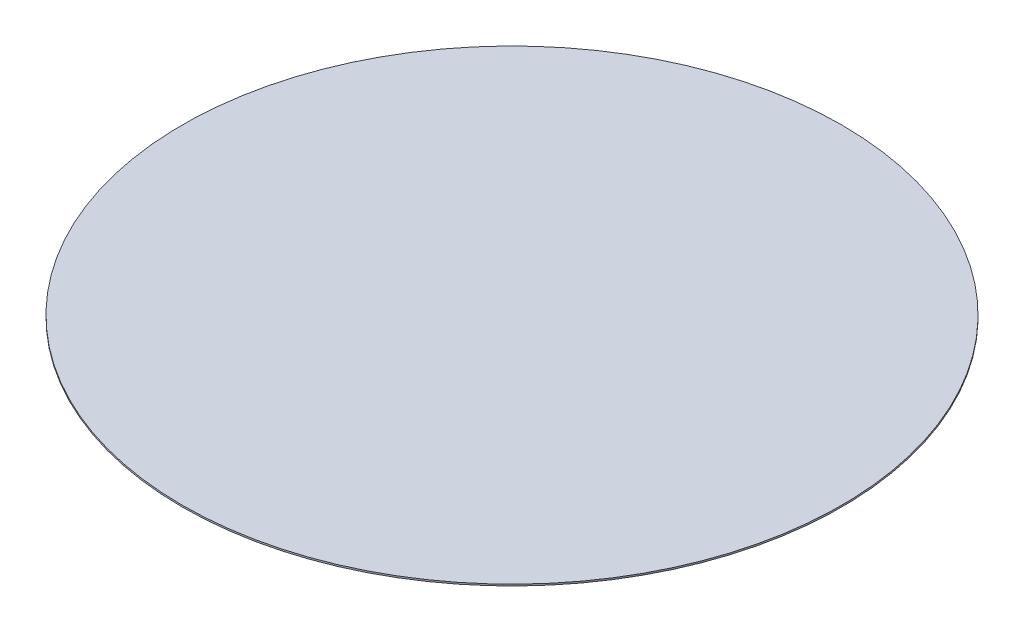
from build123d import *

# Parameters (mm, degrees)
SKETCH1_R           = 10.25
BOSS_EXTRUDE1_DEPTH = 0.05


with BuildPart() as part:
    # Sketch1 → Boss-Extrude1 (new body)
    with BuildSketch(Plane(origin=(0, 0, 0), x_dir=(1, 0, 0), z_dir=(0, 1, 0))):
        with Locations(Location((0, 0, 0), (0, 0, 270))):
            Circle(SKETCH1_R)
    extrude(amount=BOSS_EXTRUDE1_DEPTH)


solid = part.part
